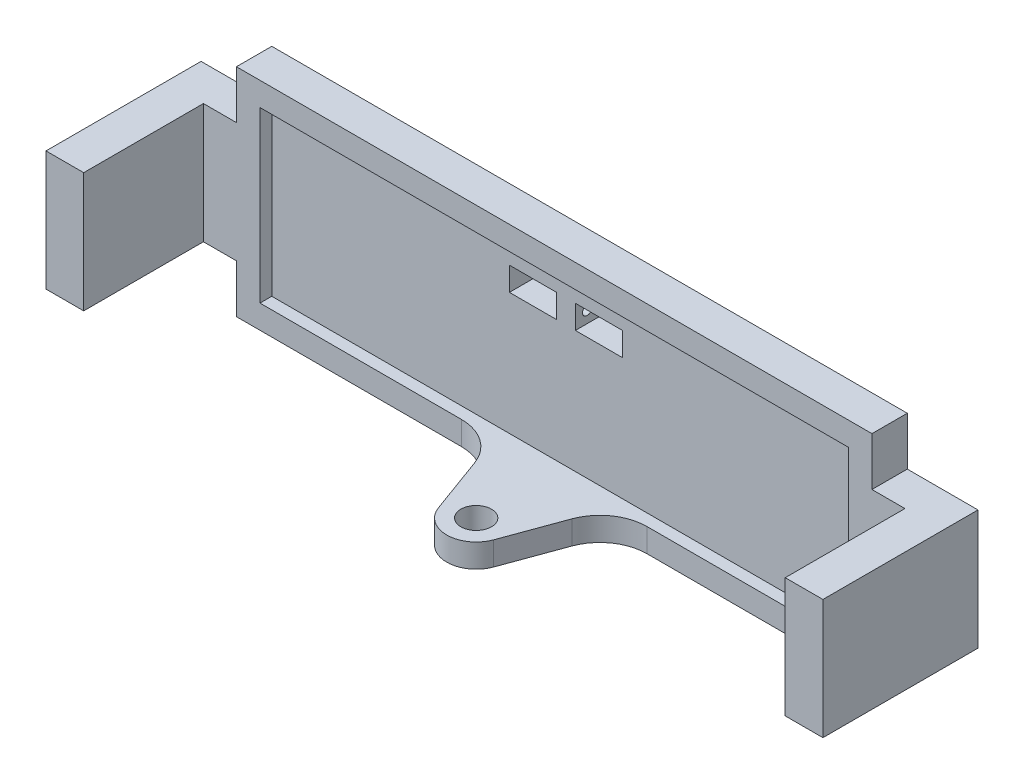
from build123d import *

# Parameters (mm, degrees)
SKETCH1_W               = 134.83
SKETCH1_H               = 45.93
SKETCH1_W_2             = 124.83
SKETCH1_H_2             = 35.93
BOSS_EXTRUDE1_DEPTH     = 2.5
BOSS_EXTRUDE2_START     = 2.5
SKETCH1_3_W             = 134.83
SKETCH1_3_H             = 45.93
SKETCH1_3_W_2           = 124.83
SKETCH1_3_H_2           = 35.93
BOSS_EXTRUDE2_DEPTH     = 2.5
SKETCH2_R               = 6.25
SKETCH2_R_2             = 3.25
BOSS_EXTRUDE3_DEPTH     = 5
FILLET1_R               = 10
CUT_EXTRUDE4_DEPTH      = 78.396792246
CUT_EXTRUDE4_DEPTH_BACK = 78.396792246
SKETCH5_W               = 10
SKETCH5_H               = 5
SKETCH6_R               = 1
CUT_EXTRUDE5_DEPTH      = 4
SKETCH7_W               = 7
SKETCH7_H               = 25.4
SKETCH7_W_2             = 8
BOSS_EXTRUDE4_DEPTH     = 7.5
BOSS_EXTRUDE5_START     = -7.5
SKETCH7_4_W             = 8
SKETCH7_4_H             = 25.4
BOSS_EXTRUDE5_DEPTH     = 25.4


with BuildPart() as part:
    # Sketch1 → Boss-Extrude1 (new, symmetric)
    # profile 1 of 2: a face of its own
    with BuildSketch(Plane.XY):
        Rectangle(SKETCH1_W, SKETCH1_H)
        Rectangle(SKETCH1_W_2, SKETCH1_H_2, mode=Mode.SUBTRACT)
    # profile 2 of 2: a face of its own
    with BuildSketch(Plane.XY):
        Rectangle(SKETCH1_W_2, SKETCH1_H_2)
    extrude(amount=BOSS_EXTRUDE1_DEPTH, both=True)

    # Sketch1<3> → Boss-Extrude2 (add, symmetric)
    with BuildSketch(Plane.XY.offset(BOSS_EXTRUDE2_START)):
        Rectangle(SKETCH1_3_W, SKETCH1_3_H)
        Rectangle(SKETCH1_3_W_2, SKETCH1_3_H_2, mode=Mode.SUBTRACT)
    extrude(amount=BOSS_EXTRUDE2_DEPTH, both=True)

    # Sketch2 → Boss-Extrude3 (add)
    # profile 1 of 2: a face of its own
    with BuildSketch(Plane.XZ.offset(22.965)):
        with BuildLine():
            ThreePointArc((6.25, 21.55), (-1.088960505, 15.395597915), (-5.870532806, 23.694608256))
            Line((-5.870532806, 23.694608256), (-12.7, 5))
            Line((-12.7, 5), (12.7, 5))
            Line((12.7, 5), (5.870532806, 23.694608256))
            ThreePointArc((5.870532806, 23.694608256), (6.154402085, 22.638960505), (6.25, 21.55))
        make_face()
    # profile 2 of 2: a face of its own
    with BuildSketch(Plane.XZ.offset(22.965)):
        with Locations((0, 21.55)):
            Circle(SKETCH2_R)
        with Locations(Location((0, 21.55, 0), (0, 0, 270))):
            Circle(SKETCH2_R_2, mode=Mode.SUBTRACT)
    extrude(amount=-BOSS_EXTRUDE3_DEPTH)

    # Fillet1
    fillet1_edges = [part.edges().sort_by_distance(p)[0] for p in [
        (-12.7, -20.465, 5),
        (12.7, -20.465, 5),
    ]]
    fillet(fillet1_edges, radius=FILLET1_R)

    # Sketch5 → Cut-Extrude4 (cut, two sides: drawn at the far end of the back side and taken through both)
    with BuildSketch(Plane(origin=(0, 0, -2.5), x_dir=(-1, 0, 0), z_dir=(0, 0, -1)).offset(-CUT_EXTRUDE4_DEPTH_BACK)):
        with Locations((7, 10.465)):
            Rectangle(SKETCH5_W, SKETCH5_H)
        with Locations((-7, 10.465)):
            Rectangle(SKETCH5_W, SKETCH5_H)
    extrude(amount=CUT_EXTRUDE4_DEPTH + CUT_EXTRUDE4_DEPTH_BACK, mode=Mode.SUBTRACT)

    # Sketch6 → Cut-Extrude5 (cut)
    with BuildSketch(Plane.ZY.offset(2)):
        with Locations((0, 10.465)):
            Circle(SKETCH6_R)
    extrude(amount=-CUT_EXTRUDE5_DEPTH, mode=Mode.SUBTRACT)

    # Sketch7 → Boss-Extrude4 (add)
    with BuildSketch(Plane(origin=(0, 0, -2.5), x_dir=(-1, 0, 0), z_dir=(0, 0, -1))):
        with Locations((-70.915, 0)):
            Rectangle(SKETCH7_W, SKETCH7_H)
        with Locations((-78.415, 0)):
            Rectangle(SKETCH7_W_2, SKETCH7_H)
        with Locations((78.415, 0)):
            Rectangle(SKETCH7_W_2, SKETCH7_H)
        with Locations((70.915, 0)):
            Rectangle(SKETCH7_W, SKETCH7_H)
    extrude(amount=-BOSS_EXTRUDE4_DEPTH)

    # Sketch7<4> → Boss-Extrude5 (add)
    with BuildSketch(Plane(origin=(0, 0, -2.5), x_dir=(-1, 0, 0), z_dir=(0, 0, -1)).offset(BOSS_EXTRUDE5_START)):
        with Locations((-78.415, 0)):
            Rectangle(SKETCH7_4_W, SKETCH7_4_H)
        with Locations((78.415, 0)):
            Rectangle(SKETCH7_4_W, SKETCH7_4_H)
    extrude(amount=-BOSS_EXTRUDE5_DEPTH)


solid = part.part
